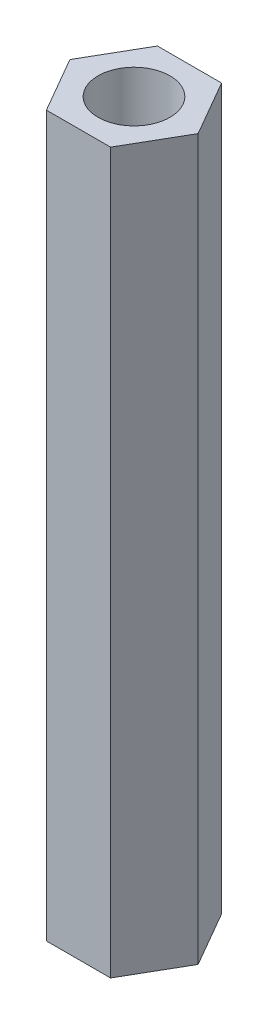
from build123d import *

# Parameters (mm, degrees)
SKETCH1_R           = 1.5
BOSS_EXTRUDE1_DEPTH = 30


with BuildPart() as part:
    # Sketch1 → Boss-Extrude1 (new body)
    with BuildSketch(Plane(origin=(0, 0, 0), x_dir=(1, 0, 0), z_dir=(0, 1, 0))):
        Polygon((2.673131746, 0), (1.336565873, 2.315), (-1.336565873, 2.315), (-2.673131746, 0), (-1.336565873, -2.315), (1.336565873, -2.315), align=None)
        with Locations(Location((0, 0, 0), (0, 0, 270))):
            Circle(SKETCH1_R, mode=Mode.SUBTRACT)
    extrude(amount=BOSS_EXTRUDE1_DEPTH)


solid = part.part
